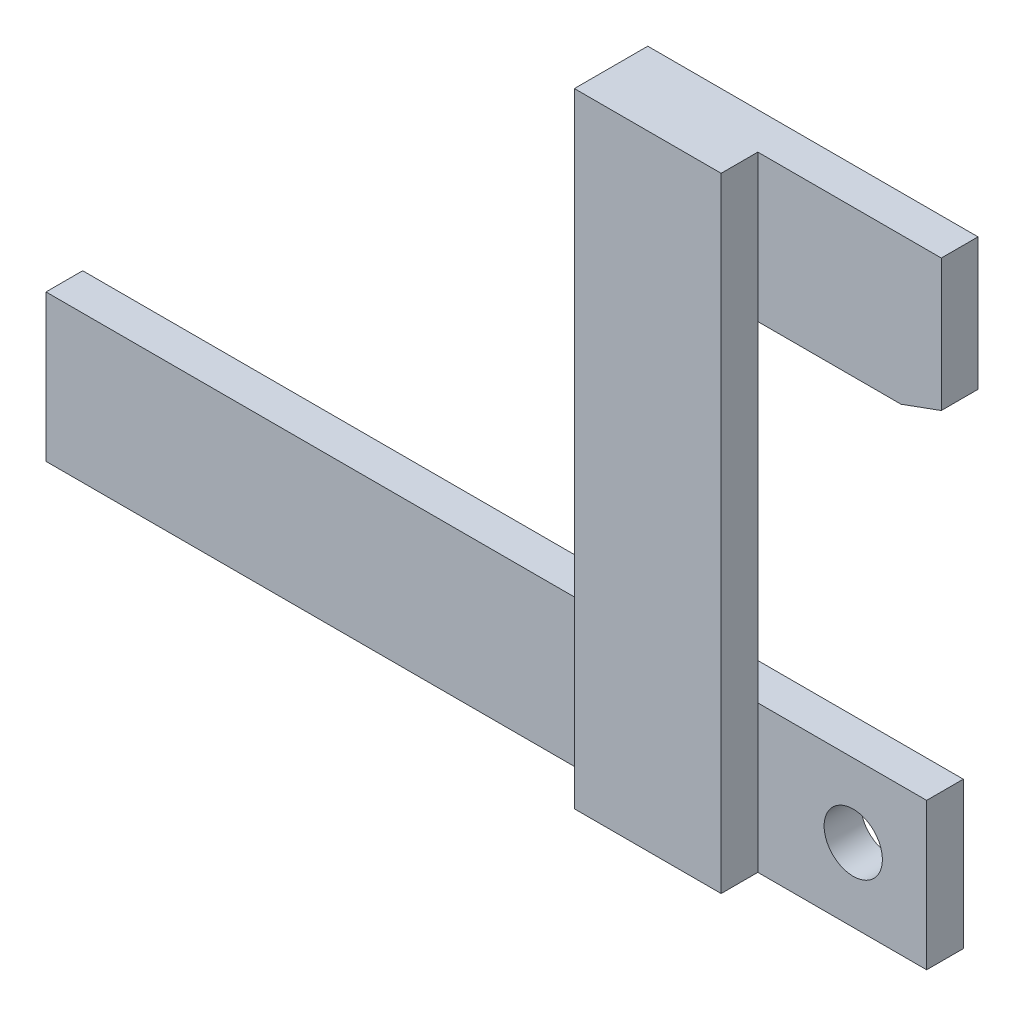
from build123d import *

# Parameters (mm, degrees)
SKETCH1_W                   = 152.4
SKETCH1_H                   = 25.4
EXTRUDE1_DEPTH              = 6.35
SKETCH2_W                   = 25.4
SKETCH2_H                   = 107.95
EXTRUDE2_DEPTH              = 6.35
SKETCH3_W                   = 57.15
SKETCH3_H                   = 25.4
EXTRUDE3_DEPTH              = 6.35
CHAMFER1_SIZE               = 2.54
CHAMFER1_SIZE2              = 6.978592645
F_3_8_CLEARANCE_HOLE1_D     = 10.0838
F_3_8_CLEARANCE_HOLE1_DEPTH = 38.1
F_3_8_CLEARANCE_HOLE1_TIP   = 3.029479155


with BuildPart() as part:
    # Sketch1 → Extrude1 (new body)
    with BuildSketch(Plane.XY):
        Rectangle(SKETCH1_W, SKETCH1_H)
    extrude(amount=EXTRUDE1_DEPTH)

    # Sketch2 → Extrude2 (add)
    with BuildSketch(Plane.XY.offset(6.35)):
        with Locations((34.29, 41.275)):
            Rectangle(SKETCH2_W, SKETCH2_H)
    extrude(amount=EXTRUDE2_DEPTH)

    # Sketch3 → Extrude3 (add)
    with BuildSketch(Plane(origin=(0, 0, 6.35), x_dir=(-1, 0, 0), z_dir=(0, 0, -1))):
        with Locations((-50.165, 82.55)):
            Rectangle(SKETCH3_W, SKETCH3_H)
    extrude(amount=EXTRUDE3_DEPTH)

    # Chamfer1
    chamfer1_edges = [part.edges().sort_by_distance(p)[0] for p in [
        (78.74, 69.85, 3.175),
    ]]
    chamfer1_side = [part.faces().sort_by_distance(p)[0] for p in [
        (78.74, 82.55, 3.175),
    ]]
    chamfer(chamfer1_edges, length=CHAMFER1_SIZE, length2=CHAMFER1_SIZE2, reference=chamfer1_side[0])

    # 3/8 Clearance Hole1
    with Locations(Plane(origin=(63.5, 0, 6.35), x_dir=(1, 0, 0), z_dir=(0, 0, 1))):
        with Locations((0, 0)):
            Hole(F_3_8_CLEARANCE_HOLE1_D / 2, depth=F_3_8_CLEARANCE_HOLE1_DEPTH)
            with Locations((0, 0, -(F_3_8_CLEARANCE_HOLE1_DEPTH + F_3_8_CLEARANCE_HOLE1_TIP / 2))):  # 118° drill point
                Cone(0, F_3_8_CLEARANCE_HOLE1_D / 2, F_3_8_CLEARANCE_HOLE1_TIP, mode=Mode.SUBTRACT)


solid = part.part
